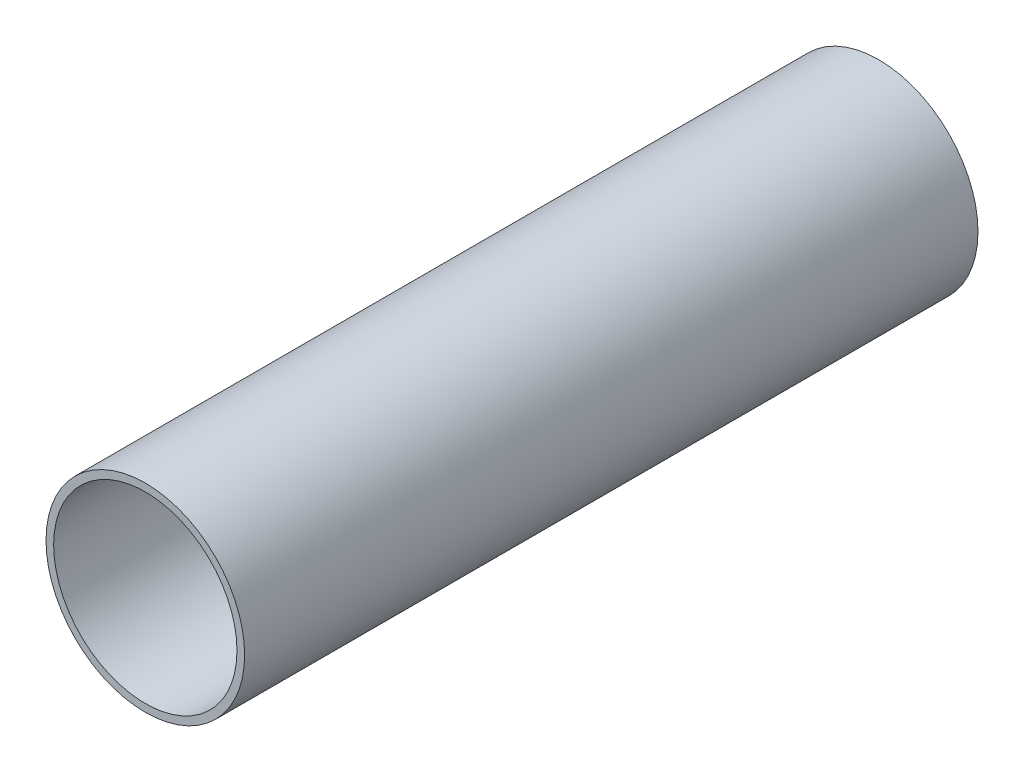
from build123d import *

# Parameters (mm, degrees)
SKETCH1_R           = 82.55
SKETCH1_R_2         = 76.2
BOSS_EXTRUDE1_DEPTH = 609.6


with BuildPart() as part:
    # Sketch1 → Boss-Extrude1 (new body)
    with BuildSketch(Plane.XY):
        with Locations(Location((0, 0, 0), (0, 0, 180))):
            Circle(SKETCH1_R)
        with Locations(Location((0, 0, 0), (0, 0, 180))):
            Circle(SKETCH1_R_2, mode=Mode.SUBTRACT)
    extrude(amount=BOSS_EXTRUDE1_DEPTH)


solid = part.part
